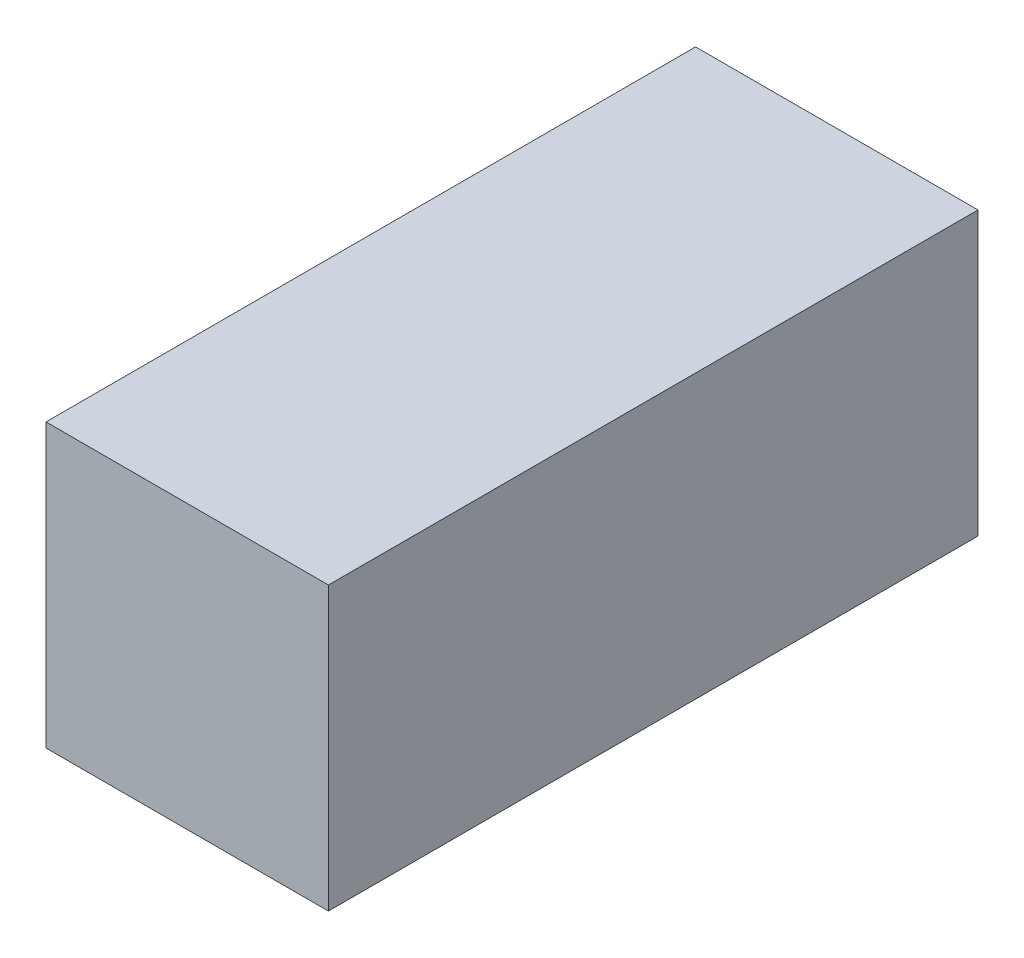
from build123d import *

# Parameters (mm, degrees)
SKETCH1_W           = 100
SKETCH1_H           = 100
BOSS_EXTRUDE1_DEPTH = 230
SHELL2_T            = 2.5
BOSS_EXTRUDE2_DEPTH = 47.5
SKETCH2_3_R         = 10
BOSS_EXTRUDE3_DEPTH = 95
SKETCH4_R           = 10
BOSS_EXTRUDE5_DEPTH = 100
BOSS_EXTRUDE7_REACH = 256.767
SKETCH5_R           = 10
SKETCH5_W           = 25
SKETCH5_H           = 60
SKETCH6_W           = 90
SKETCH6_H           = 90
BOSS_EXTRUDE8_DEPTH = 100


with BuildPart() as part:
    # Sketch1 → Boss-Extrude1 (new body)
    with BuildSketch(Plane.XY):
        Rectangle(SKETCH1_W, SKETCH1_H)
    extrude(amount=BOSS_EXTRUDE1_DEPTH)

    # Shell2 (no face opened: a closed hollow body)
    add(offset(amount=-SHELL2_T, mode=Mode.PRIVATE), mode=Mode.SUBTRACT)


with BuildPart() as body_2:
    # Sketch2 → Boss-Extrude2 (new body)
    with BuildSketch(Plane(origin=(-47.5, 0, 0), x_dir=(0, 0, -1), z_dir=(1, 0, 0))):
        Polygon((-122.5, 43.336516415), (-122.5, -47.5), (-22.5, -47.5), (-22.5, -27.5), (-22.5, 43.336516415), align=None)
    extrude(amount=BOSS_EXTRUDE2_DEPTH)


with BuildPart() as body_3:
    # Sketch2<3> → Boss-Extrude3 (new body)
    with BuildSketch(Plane(origin=(-47.5, 0, 0), x_dir=(0, 0, -1), z_dir=(1, 0, 0))):
        with Locations(Location((-12.5, -27.5, 0), (0, 0, 180))):
            Circle(SKETCH2_3_R)
    extrude(amount=BOSS_EXTRUDE3_DEPTH)


with BuildPart() as body_4:
    # Sketch4 → Boss-Extrude5 (new body)
    with BuildSketch(Plane.XY.offset(2.5)):
        with Locations((10, 27.5)):
            Circle(SKETCH4_R)
    extrude(amount=BOSS_EXTRUDE5_DEPTH)


with BuildPart() as body_5:

    # Sketch5 → Boss-Extrude7 (new, up to next)
    with BuildSketch(Plane.XZ.offset(-47.5), mode=Mode.PRIVATE) as boss_extrude7_sk1:
        with Locations(Location((37.5, 102.5, 0), (0, 0, 90))):
            Circle(SKETCH5_R)
    boss_extrude7_tool1 = extrude(boss_extrude7_sk1.sketch, amount=BOSS_EXTRUDE7_REACH, mode=Mode.PRIVATE) - part.part
    # Sketch5 → Boss-Extrude7 (new, up to next)
    with BuildSketch(Plane.XZ.offset(-47.5), mode=Mode.PRIVATE) as boss_extrude7_sk2:
        with Locations((35, 57.5)):
            Rectangle(SKETCH5_W, SKETCH5_H)
    boss_extrude7_tool2 = extrude(boss_extrude7_sk2.sketch, amount=BOSS_EXTRUDE7_REACH, mode=Mode.PRIVATE) - part.part
    add(boss_extrude7_tool1.solids().sort_by_distance((37.5, 47.5, 102.5))[0])
    add(boss_extrude7_tool2.solids().sort_by_distance((35, 47.5, 57.5))[0])


with BuildPart() as part_1:
    add(part.part)

    # Sketch6 → Boss-Extrude8 (add)
    with BuildSketch(Plane(origin=(0, 0, 227.5), x_dir=(-1, 0, 0), z_dir=(0, 0, -1))):
        Rectangle(SKETCH6_W, SKETCH6_H)
    extrude(amount=BOSS_EXTRUDE8_DEPTH)


solid = Compound([body_2.part, body_3.part, body_4.part, body_5.part, part_1.part])
